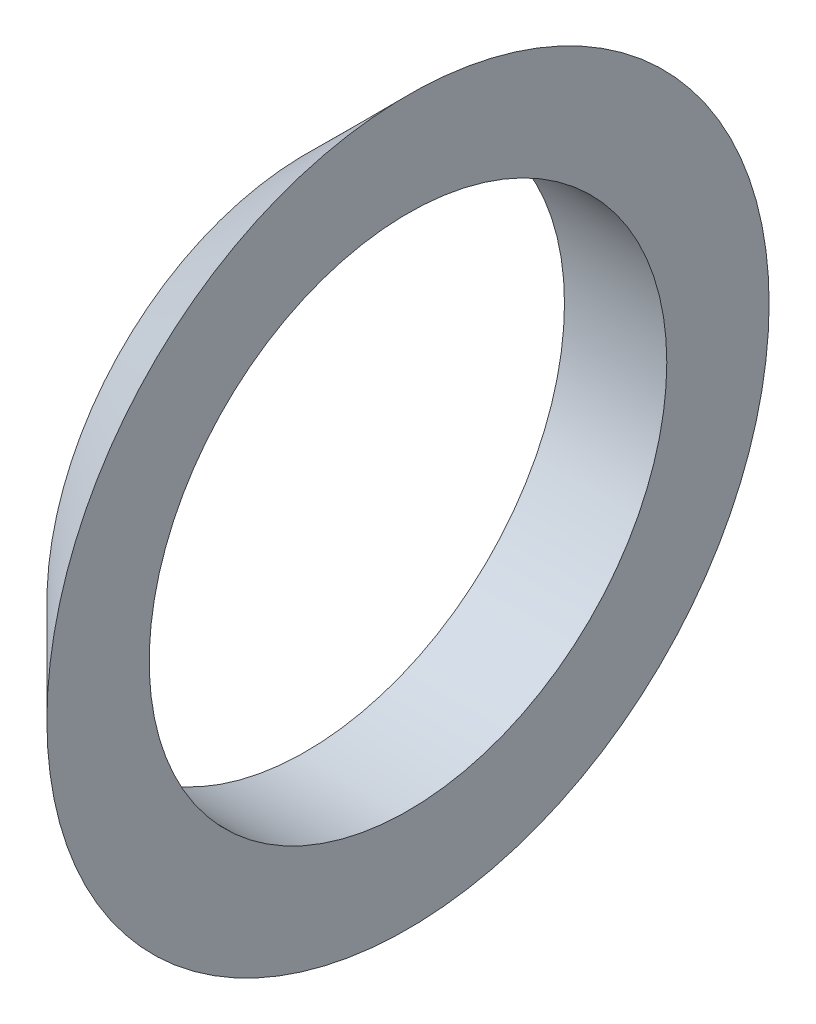
from build123d import *


with BuildPart() as part:
    # Sketch2 → Revolve2 (revolve)
    with BuildSketch(Plane(origin=(0, 0, 0), x_dir=(0, 1, 0), z_dir=(0, 0, 1)), mode=Mode.PRIVATE) as revolve2_sk:
        Polygon((-76.2, 0), (-54.61, 0), (-54.61, 21.59), align=None)
    revolve(revolve2_sk.sketch.rotate(Axis((0, 0, 0), (-1, 0, 0)), 270), axis=Axis((0, 0, 0), (-1, 0, 0)))


solid = part.part
